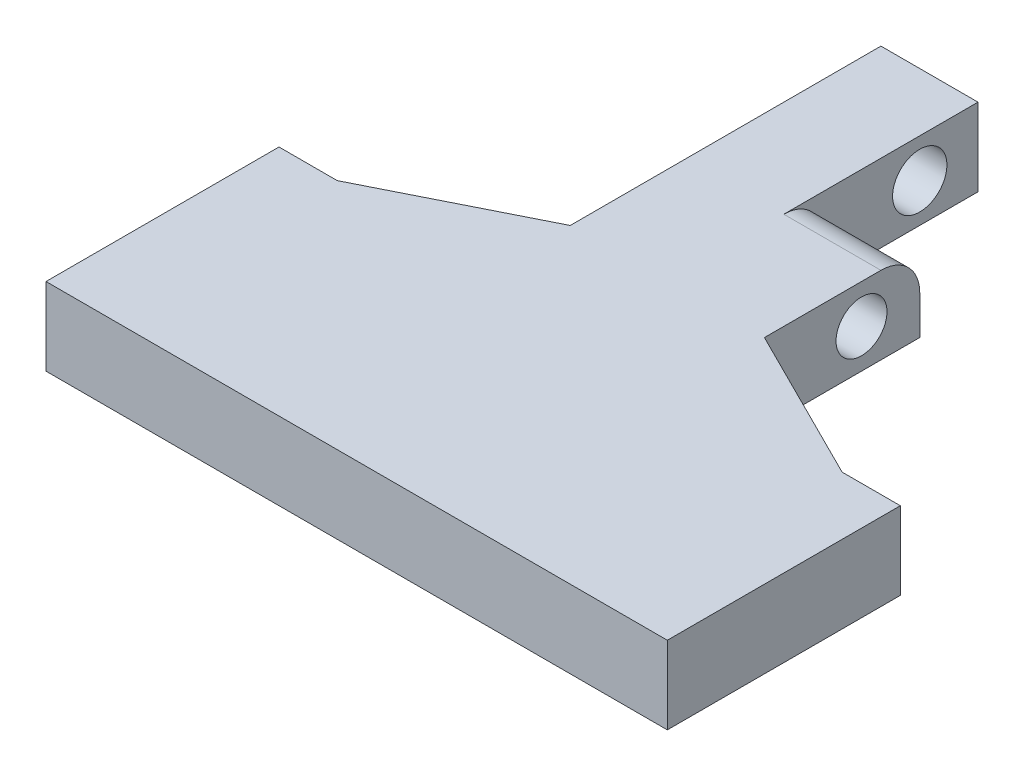
from build123d import *

# Parameters (mm, degrees)
BOSS_EXTRUDE1_DEPTH = 6.35
SKETCH4_R           = 2.0828
SKETCH4_R_2         = 2.2225
CUT_EXTRUDE1_DEPTH  = 50.8
SKETCH5_W           = 7.9375
SKETCH5_H           = 12.7
CUT_EXTRUDE2_DEPTH  = 6.35
FILLET1_R           = 3.175


with BuildPart() as part:
    # Sketch3 → Boss-Extrude1 (new body)
    with BuildSketch(Plane(origin=(0, 0, 0), x_dir=(1, 0, 0), z_dir=(0, 1, 0))):
        Polygon((55.304809527, 7.379629834), (47.367309527, 7.379629834), (47.367309527, -11.670370166), (72.767309527, -11.670370166), (72.767309527, 7.379629834), (68.004809527, 7.379629834), align=None)
        Polygon((26.729809527, 7.379629834), (39.429809527, 7.379629834), (39.429809527, 13.729629834), align=None)
        Polygon((55.304809527, 13.729629834), (55.304809527, 7.379629834), (68.004809527, 7.379629834), align=None)
        Polygon((47.367309527, -11.670370166), (47.367309527, 7.379629834), (39.429809527, 7.379629834), (26.729809527, 7.379629834), (21.967309527, 7.379629834), (21.967309527, -11.670370166), align=None)
        Polygon((55.304809527, 39.129629834), (47.367309527, 39.129629834), (47.367309527, 7.379629834), (55.304809527, 7.379629834), (55.304809527, 13.729629834), align=None)
        Polygon((47.367309527, 7.379629834), (47.367309527, 39.129629834), (39.429809527, 39.129629834), (39.429809527, 13.729629834), (39.429809527, 7.379629834), align=None)
    extrude(amount=BOSS_EXTRUDE1_DEPTH)

    # Sketch4 → Cut-Extrude1 (cut)
    with BuildSketch(Plane(origin=(55.304809527, 0, 0), x_dir=(0, 0, -1), z_dir=(1, 0, 0))):
        with Locations((21.667129834, 3.175)):
            Circle(SKETCH4_R)
        with Locations((34.367129834, 3.175)):
            Circle(SKETCH4_R_2)
    extrude(amount=-CUT_EXTRUDE1_DEPTH, mode=Mode.SUBTRACT)

    # Sketch5 → Cut-Extrude2 (cut)
    with BuildSketch(Plane(origin=(0, 6.35, 0), x_dir=(1, 0, 0), z_dir=(0, 1, 0))):
        with Locations((51.336059527, 32.779629834)):
            Rectangle(SKETCH5_W, SKETCH5_H)
    extrude(amount=-CUT_EXTRUDE2_DEPTH, mode=Mode.SUBTRACT)

    # Fillet1
    fillet1_edges = [part.edges().sort_by_distance(p)[0] for p in [
        (51.336059527, 6.35, -26.429629834),
    ]]
    fillet(fillet1_edges, radius=FILLET1_R)


solid = part.part
